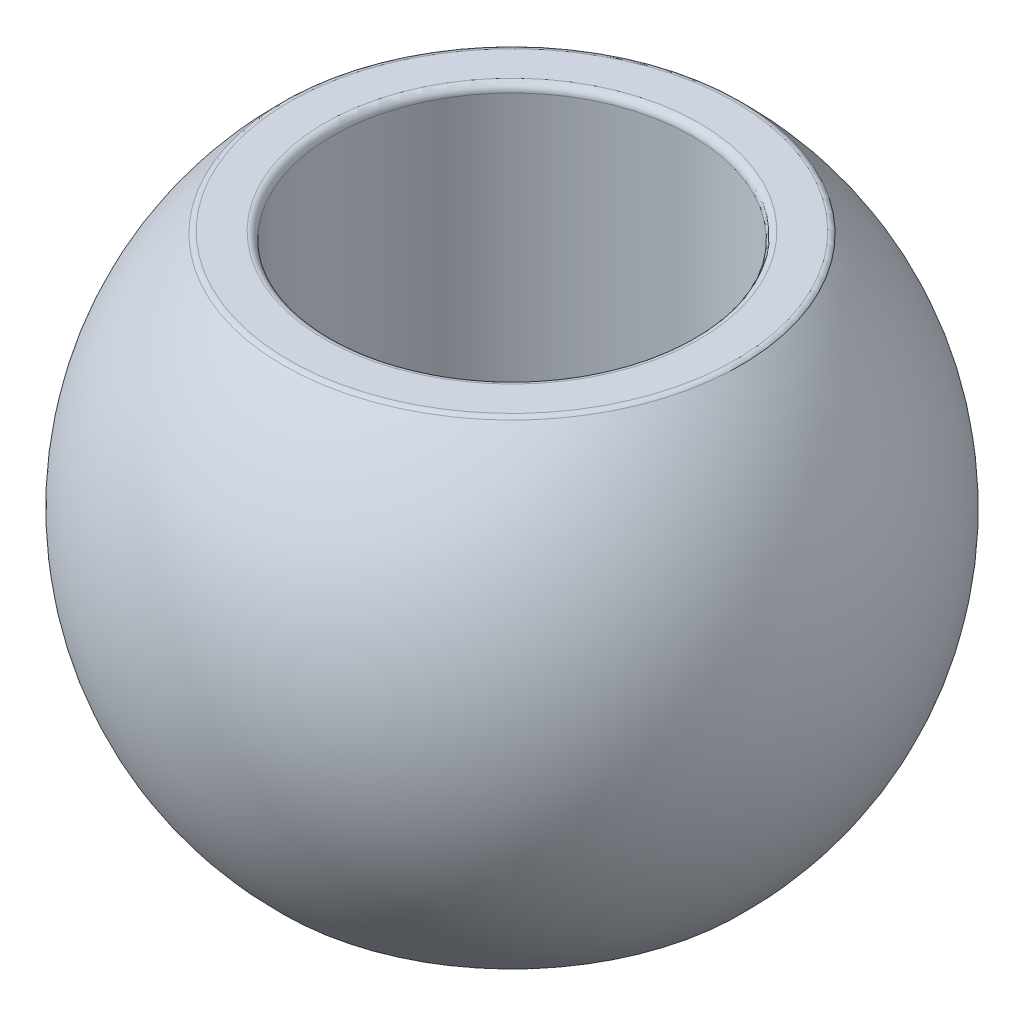
from build123d import *

# Parameters (mm, degrees)
SKETCH2_R          = 6
CUT_EXTRUDE1_DEPTH = 23.315913604
FILLET1_R          = 0.25


with BuildPart() as part:
    # Sketch1 → Revolve2 (revolve)
    with BuildSketch(Plane(origin=(0, 0, 0), x_dir=(0, 0, -1), z_dir=(1, 0, 0))):
        with BuildLine():
            Line((0, -8), (7.549834435, -8))
            ThreePointArc((7.549834435, -8), (11, 0), (7.549834435, 8))
            Line((7.549834435, 8), (0, 8))
            Line((0, 8), (0, -8))
        make_face()
    revolve(axis=Axis((0, 11, 0), (0, -1, 0)))

    # Sketch2 → Cut-Extrude1 (cut, through all)
    with BuildSketch(Plane(origin=(0, 8, 0), x_dir=(1, 0, 0), z_dir=(0, 1, 0))):
        with Locations(Location((0, 0, 0), (0, 0, 270))):
            Circle(SKETCH2_R)
    extrude(amount=-CUT_EXTRUDE1_DEPTH, mode=Mode.SUBTRACT)

    # Fillet1
    fillet1_edges = [part.edges().sort_by_distance(p)[0] for p in [
        (0, -8, -6),
        (0, 8, -6),
        (0, -8, 7.549834435),
        (0, 8, 7.549834435),
    ]]
    fillet(fillet1_edges, radius=FILLET1_R)


solid = part.part
